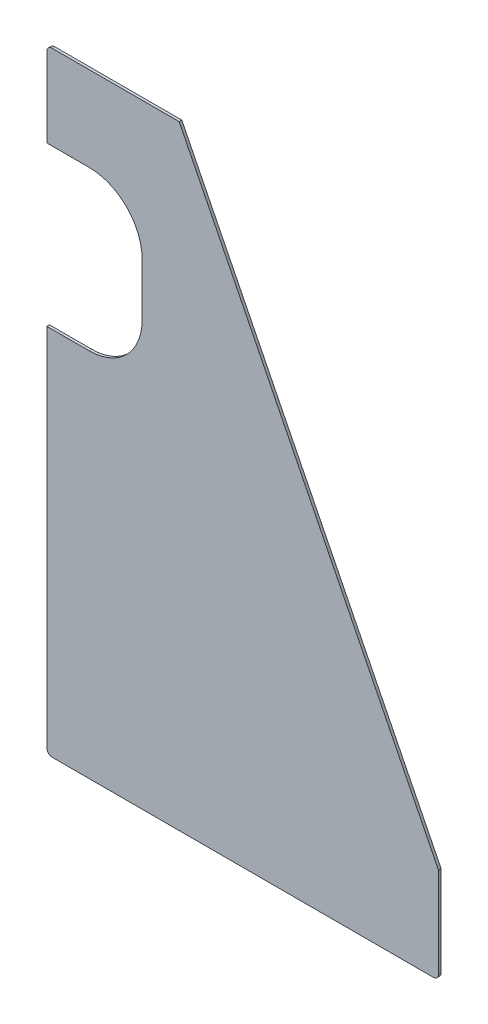
from build123d import *

# Parameters (mm, degrees)
SKETCH1_W           = 740
SKETCH1_H           = 1160
BOSS_EXTRUDE1_DEPTH = 5
FILLET1_R           = 10
CUT_EXTRUDE1_DEPTH  = 688.986191722
SKETCH3_W           = 360
SKETCH3_H           = 300
CUT_EXTRUDE2_DEPTH  = 688.986191722
FILLET2_R           = 100


with BuildPart() as part:
    # Sketch1 → Boss-Extrude1 (new body)
    with BuildSketch(Plane.XY):
        Rectangle(SKETCH1_W, SKETCH1_H)
    extrude(amount=BOSS_EXTRUDE1_DEPTH)

    # Fillet1
    fillet1_edges = [part.edges().sort_by_distance(p)[0] for p in [
        (370, -580, 2.5),
        (-370, -580, 2.5),
        (-370, 580, 2.5),
        (370, 580, 2.5),
    ]]
    fillet(fillet1_edges, radius=FILLET1_R)

    # Sketch2 → Cut-Extrude1 (cut, through all)
    with BuildSketch(Plane(origin=(0, 0, 0), x_dir=(-1, 0, 0), z_dir=(0, 0, -1))):
        Polygon((-370, -400), (120, 580), (-370, 580), align=None)
    extrude(amount=-CUT_EXTRUDE1_DEPTH, mode=Mode.SUBTRACT)

    # Sketch3 → Cut-Extrude2 (cut, through all)
    with BuildSketch(Plane.XY.offset(5)):
        with Locations((-370, 270)):
            Rectangle(SKETCH3_W, SKETCH3_H)
    extrude(amount=-CUT_EXTRUDE2_DEPTH, mode=Mode.SUBTRACT)

    # Fillet2
    fillet2_edges = [part.edges().sort_by_distance(p)[0] for p in [
        (-190, 120, 2.5),
        (-190, 420, 2.5),
    ]]
    fillet(fillet2_edges, radius=FILLET2_R)


solid = part.part
